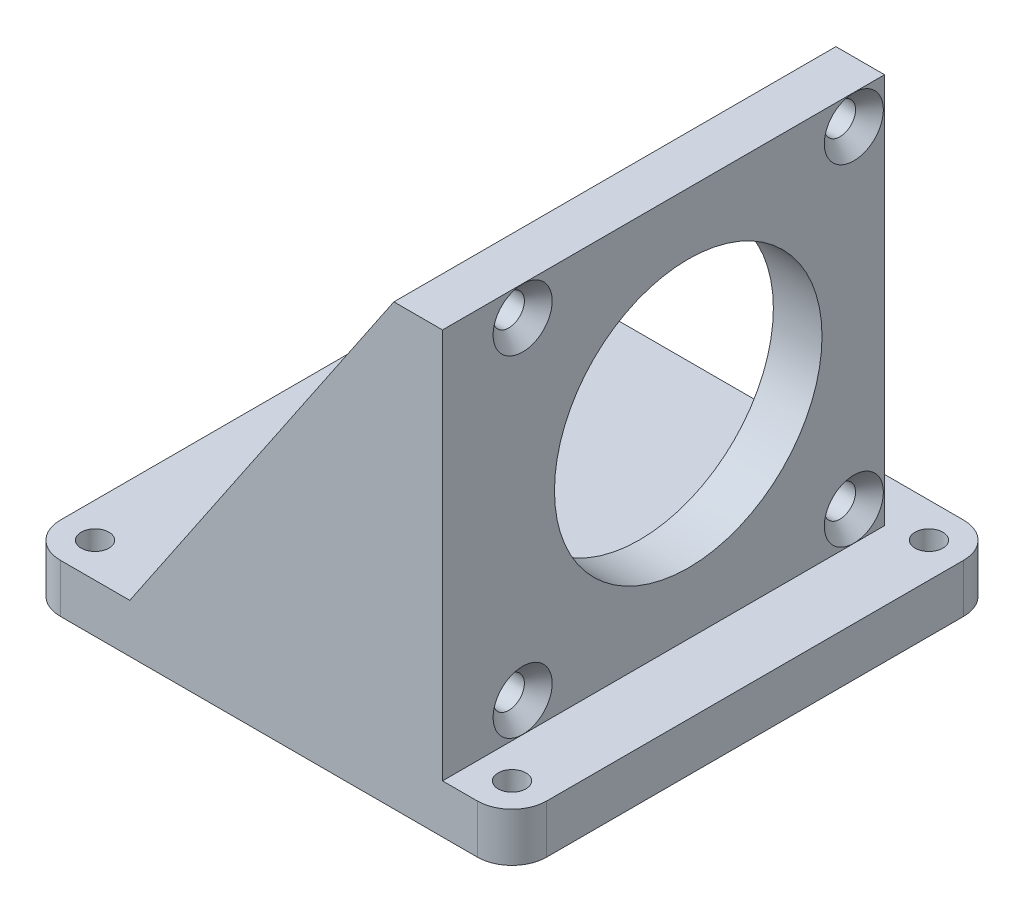
from build123d import *

# Parameters (mm, degrees)
SKETCH1_W           = 56.5
SKETCH1_H           = 56.2
SKETCH1_R           = 19.25
SKETCH1_R_2         = 2.25
BOSS_EXTRUDE1_DEPTH = 3.5
SKETCH2_R           = 2
BOSS_EXTRUDE2_DEPTH = 7
BOSS_EXTRUDE3_START = 35
BOSS_EXTRUDE3_DEPTH = 7.11128839
CHAMFER1_SIZE       = 2


with BuildPart() as part:
    # Sketch1 → Boss-Extrude1 (new, symmetric)
    with BuildSketch(Plane(origin=(0, 0, 0), x_dir=(0, 0, -1), z_dir=(1, 0, 0))):
        with Locations((0.36128839, 0)):
            Rectangle(SKETCH1_W, SKETCH1_H)
        with Locations((0.36128839, 0)):
            Circle(SKETCH1_R, mode=Mode.SUBTRACT)
        with Locations((-23.468210136, 23.829498526)):
            Circle(SKETCH1_R_2, mode=Mode.SUBTRACT)
        with Locations(Location((24.190786916, 23.829498526, 0), (0, 0, 180))):
            Circle(SKETCH1_R_2, mode=Mode.SUBTRACT)
        with Locations((24.190786916, -23.829498526)):
            Circle(SKETCH1_R_2, mode=Mode.SUBTRACT)
        with Locations(Location((-23.468210136, -23.829498526, 0), (0, 0, 180))):
            Circle(SKETCH1_R_2, mode=Mode.SUBTRACT)
    extrude(amount=BOSS_EXTRUDE1_DEPTH, both=True)

    # Sketch2 → Boss-Extrude2 (add)
    with BuildSketch(Plane.XZ.offset(28.1)):
        with BuildLine():
            Line((-51.5, 35), (8.5, 35))
            ThreePointArc((8.5, 35), (12.035533906, 33.535533906), (13.5, 30))
            Line((13.5, 30), (13.5, -30))
            ThreePointArc((13.5, -30), (12.035533906, -33.535533906), (8.5, -35))
            Line((8.5, -35), (-51.5, -35))
            ThreePointArc((-51.5, -35), (-55.035533906, -33.535533906), (-56.5, -30))
            Line((-56.5, -30), (-56.5, 30))
            ThreePointArc((-56.5, 30), (-55.035533906, 33.535533906), (-51.5, 35))
        make_face()
        with Locations(Location((8.5, 30, 0), (0, 0, 270))):
            Circle(SKETCH2_R, mode=Mode.SUBTRACT)
        with Locations(Location((8.5, -30, 0), (0, 0, 90))):
            Circle(SKETCH2_R, mode=Mode.SUBTRACT)
        with Locations(Location((-51.5, 30, 0), (0, 0, 90))):
            Circle(SKETCH2_R, mode=Mode.SUBTRACT)
        with Locations(Location((-51.5, -30, 0), (0, 0, 270))):
            Circle(SKETCH2_R, mode=Mode.SUBTRACT)
    extrude(amount=BOSS_EXTRUDE2_DEPTH)

    # Sketch4 → Boss-Extrude3 (add)
    with BuildSketch(Plane.XY.offset(BOSS_EXTRUDE3_START)):
        Polygon((-41.5, -28.1), (-3.5, 28.1), (3.5, 28.1), (3.5, -28.1), align=None)
    extrude(amount=-BOSS_EXTRUDE3_DEPTH)

    # Chamfer1
    chamfer1_edges = [part.edges().sort_by_distance(p)[0] for p in [
        (3.5, 23.829498526, 25.718210136),
        (3.5, 23.829498526, -26.440786916),
        (3.5, -23.829498526, -21.940786916),
        (3.5, -23.829498526, 21.218210136),
    ]]
    chamfer(chamfer1_edges, length=CHAMFER1_SIZE)


solid = part.part
